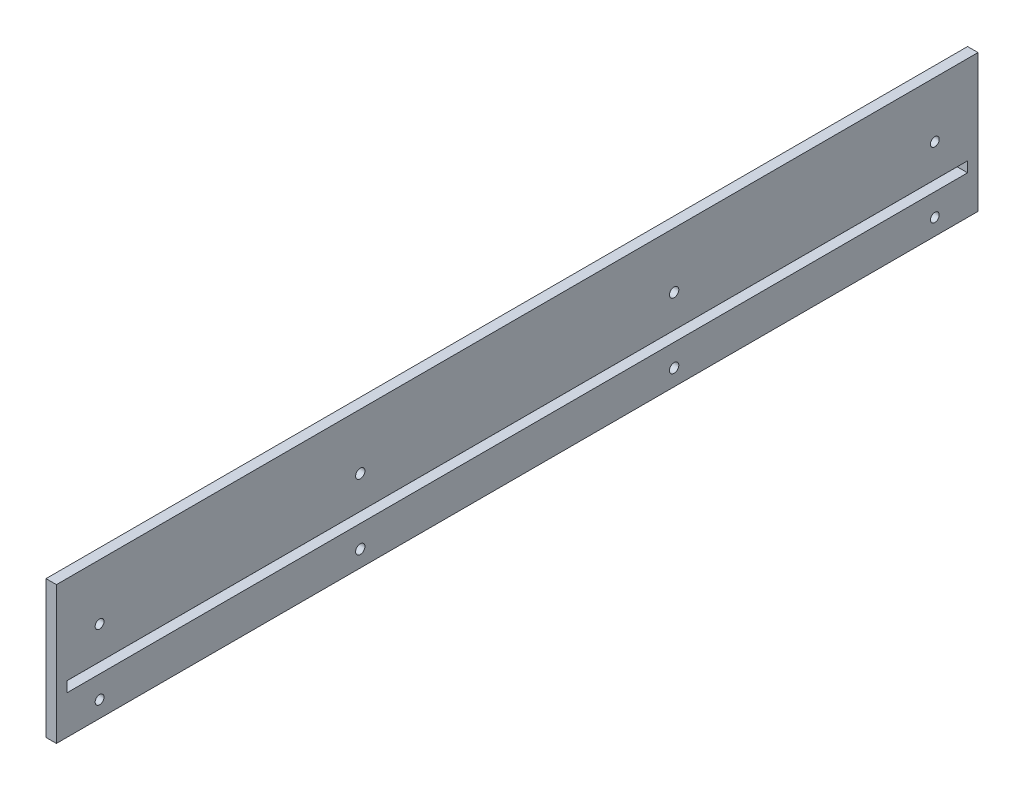
from build123d import *

# Parameters (mm, degrees)
SKETCH1_W                 = 281.36
SKETCH1_H                 = 30
BOSS_EXTRUDE1_DEPTH       = 3.18
CUT_EXTRUDE1_REACH        = 143.513
SKETCH2_R                 = 1.35
SKETCH2_R_2               = 1.425
MIRROR2_COPY_1_REACH      = 143.513
MIRROR2_COPY_1_SKETCH_R   = 1.35
MIRROR2_COPY_1_SKETCH_R_2 = 1.425
SKETCH3_W                 = 275
SKETCH3_H                 = 3.19
CUT_EXTRUDE2_DEPTH        = 3.18
SKETCH4_W                 = 3.18
SKETCH4_H                 = 281.36
BOSS_EXTRUDE2_DEPTH       = 12


with BuildPart() as part:
    # Sketch1 → Boss-Extrude1 (new body)
    with BuildSketch(Plane(origin=(0, 0, 0), x_dir=(0, 0, -1), z_dir=(1, 0, 0))):
        Rectangle(SKETCH1_W, SKETCH1_H)
    extrude(amount=BOSS_EXTRUDE1_DEPTH)

    # Sketch2 → Cut-Extrude1 (cut, up to next)
    with BuildSketch(Plane.ZY, mode=Mode.PRIVATE) as cut_extrude1_sk1:
        with Locations((-127.5, 10)):
            Circle(SKETCH2_R)
    cut_extrude1_tool1 = extrude(cut_extrude1_sk1.sketch, amount=-CUT_EXTRUDE1_REACH, mode=Mode.PRIVATE) & part.part
    # Sketch2 → Cut-Extrude1 (cut, up to next)
    with BuildSketch(Plane.ZY, mode=Mode.PRIVATE) as cut_extrude1_sk2:
        with Locations((-47.91, 10)):
            Circle(SKETCH2_R_2)
    cut_extrude1_tool2 = extrude(cut_extrude1_sk2.sketch, amount=-CUT_EXTRUDE1_REACH, mode=Mode.PRIVATE) & part.part
    cut_extrude1_1 = cut_extrude1_tool1.solids().sort_by_distance((0, 10, -127.5))[0]
    add(cut_extrude1_1, mode=Mode.SUBTRACT)
    cut_extrude1_2 = cut_extrude1_tool2.solids().sort_by_distance((0, 10, -47.91))[0]
    add(cut_extrude1_2, mode=Mode.SUBTRACT)
    cut_extrude1 = cut_extrude1_1 + cut_extrude1_2  # Cut-Extrude1 as one shape, for the pattern or mirror that repeats it

    # Mirror1: Cut-Extrude1 across plane
    add(cut_extrude1.mirror(Plane.ZX), mode=Mode.SUBTRACT)

    # Mirror2: Cut-Extrude1 across plane
    add(cut_extrude1.mirror(Plane.XY), mode=Mode.SUBTRACT)

    # Mirror2 copy 1 sketch → Mirror2 copy 1 (cut, up to next)
    with BuildSketch(Plane(origin=(0, 0, 0), x_dir=(0, 0, -1), z_dir=(-1, 0, 0)), mode=Mode.PRIVATE) as mirror2_copy_1_sk1:
        with Locations((-127.5, 10)):
            Circle(MIRROR2_COPY_1_SKETCH_R)
    mirror2_copy_1_tool1 = extrude(mirror2_copy_1_sk1.sketch, amount=-MIRROR2_COPY_1_REACH, mode=Mode.PRIVATE) & part.part
    # Mirror2 copy 1 sketch → Mirror2 copy 1 (cut, up to next)
    with BuildSketch(Plane(origin=(0, 0, 0), x_dir=(0, 0, -1), z_dir=(-1, 0, 0)), mode=Mode.PRIVATE) as mirror2_copy_1_sk2:
        with Locations((-47.91, 10)):
            Circle(MIRROR2_COPY_1_SKETCH_R_2)
    mirror2_copy_1_tool2 = extrude(mirror2_copy_1_sk2.sketch, amount=-MIRROR2_COPY_1_REACH, mode=Mode.PRIVATE) & part.part
    add(mirror2_copy_1_tool1.solids().sort_by_distance((0, -10, 127.5))[0], mode=Mode.SUBTRACT)
    add(mirror2_copy_1_tool2.solids().sort_by_distance((0, -10, 47.91))[0], mode=Mode.SUBTRACT)

    # Sketch3 → Cut-Extrude2 (cut)
    with BuildSketch(Plane(origin=(3.18, 0, 0), x_dir=(0, 0, -1), z_dir=(1, 0, 0))):
        with Locations((0, -1.615)):
            Rectangle(SKETCH3_W, SKETCH3_H)
    extrude(amount=-CUT_EXTRUDE2_DEPTH, mode=Mode.SUBTRACT)

    # Sketch4 → Boss-Extrude2 (add)
    with BuildSketch(Plane(origin=(0, 15, 0), x_dir=(1, 0, 0), z_dir=(0, 1, 0))):
        with Locations((1.59, 0)):
            Rectangle(SKETCH4_W, SKETCH4_H)
    extrude(amount=BOSS_EXTRUDE2_DEPTH)


solid = part.part
